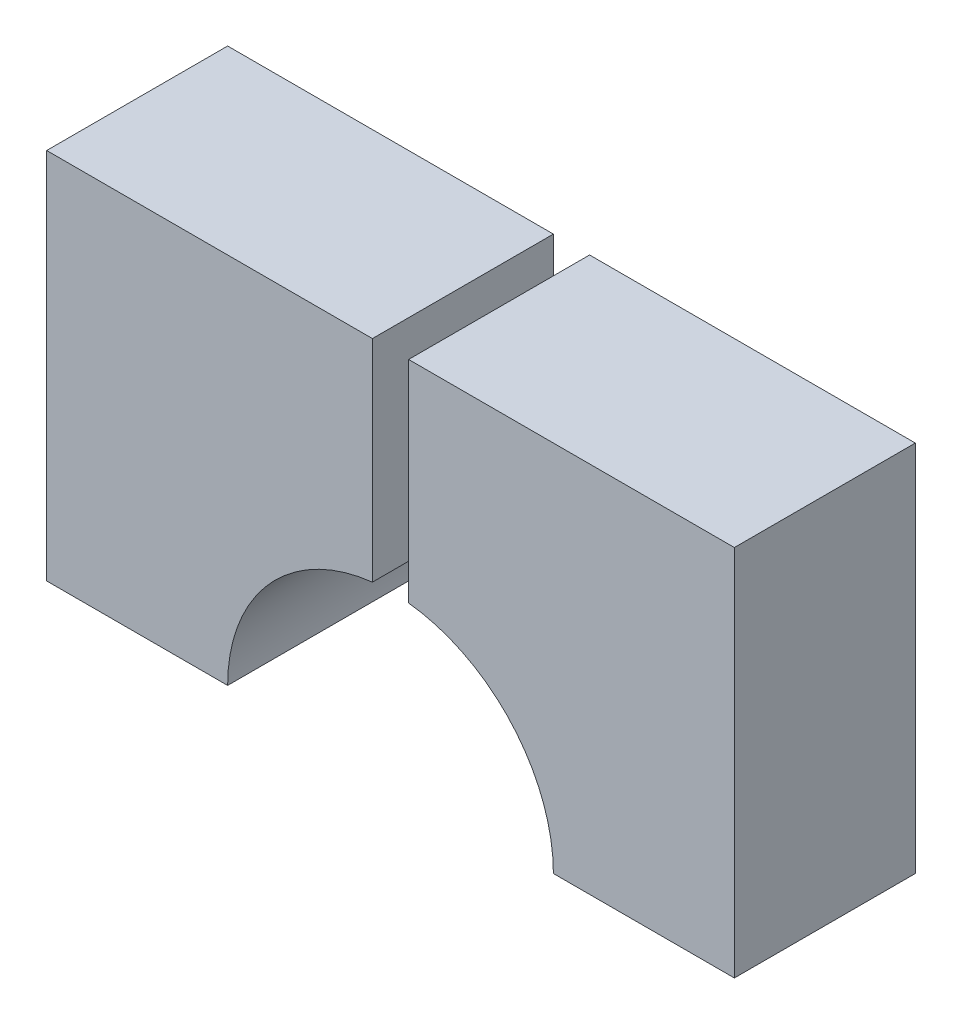
from build123d import *

# Parameters (mm, degrees)
BOSS_EXTRUDE1_START = -30
BOSS_EXTRUDE1_DEPTH = 100


with BuildPart() as part:
    # Sketch2 → Boss-Extrude1 (new body)
    with BuildSketch(Plane.XY.offset(BOSS_EXTRUDE1_START)):
        with BuildLine():
            Line((90, -505.650336196), (190, -505.650336196))
            Line((190, -505.650336196), (190, -299.650336196))
            Line((190, -299.650336196), (10, -299.650336196))
            Line((10, -299.650336196), (10, -416.207617096))
            ThreePointArc((10, -416.207617096), (67.082039325, -445.650336196), (90, -505.650336196))
        make_face()
    extrude(amount=-BOSS_EXTRUDE1_DEPTH)


with BuildPart() as body_2:
    # Mirror3: mirrored copy
    add(part.part.mirror(Plane(origin=(0, 0, 0), x_dir=(0, 0, 1), z_dir=(1, 0, 0))))


solid = Compound([part.part, body_2.part])
